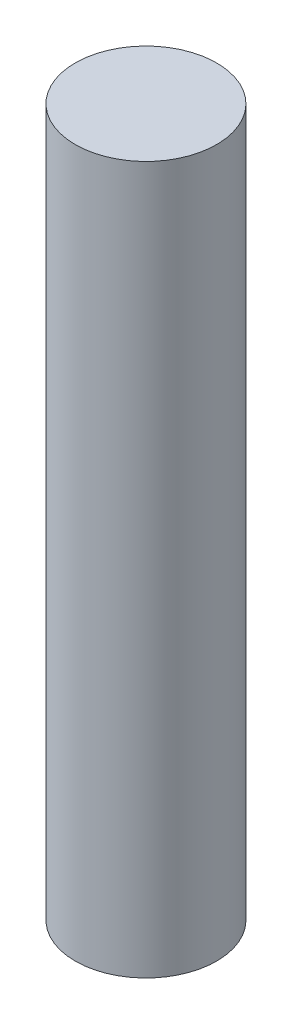
from build123d import *

# Parameters (mm, degrees)
ESQUISSE2_R        = 1
BOSS_EXTRU_1_DEPTH = 10


with BuildPart() as part:
    # Esquisse2 → Boss.-Extru.1 (new body)
    with BuildSketch(Plane(origin=(0, 0, 0), x_dir=(1, 0, 0), z_dir=(0, 1, 0))):
        with Locations(Location((0, 0, 0), (0, 0, 270))):
            Circle(ESQUISSE2_R)
    extrude(amount=BOSS_EXTRU_1_DEPTH)


solid = part.part
